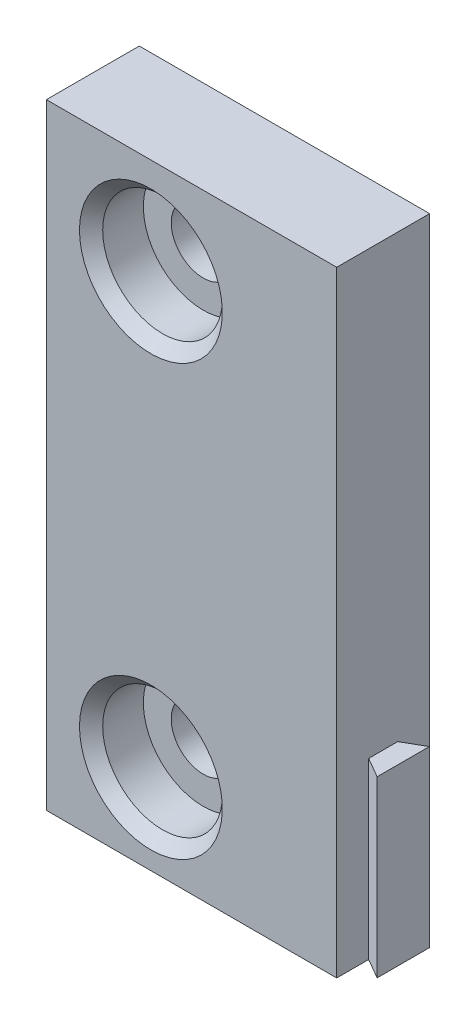
from build123d import *

# Parameters (mm, degrees)
SKETCH2_W           = 25
SKETCH2_H           = 53
SKETCH2_R           = 2.75
BOSS_EXTRUDE1_DEPTH = 8
BOSS_EXTRUDE2_DEPTH = 15
SKETCH4_R           = 5.15
CUT_EXTRUDE1_DEPTH  = 4.5
CHAMFER1_SIZE       = 1


with BuildPart() as part:
    # Sketch2 → Boss-Extrude1 (new body)
    with BuildSketch(Plane.XY):
        with Locations((12.5, 26.5)):
            Rectangle(SKETCH2_W, SKETCH2_H)
        with Locations((9, 44.7)):
            Circle(SKETCH2_R, mode=Mode.SUBTRACT)
        with Locations((9, 7.7)):
            Circle(SKETCH2_R, mode=Mode.SUBTRACT)
    extrude(amount=BOSS_EXTRUDE1_DEPTH)

    # Sketch3 → Boss-Extrude2 (add)
    with BuildSketch(Plane.XZ):
        Polygon((25, 2.75), (26.732050808, 1.75), (26.732050808, 6.25), (25, 5.25), align=None)
    extrude(amount=-BOSS_EXTRUDE2_DEPTH)

    # Sketch4 → Cut-Extrude1 (cut)
    with BuildSketch(Plane.XY.offset(8)):
        with Locations((9, 44.7)):
            Circle(SKETCH4_R)
        with Locations((9, 7.7)):
            Circle(SKETCH4_R)
    extrude(amount=-CUT_EXTRUDE1_DEPTH, mode=Mode.SUBTRACT)

    # Chamfer1
    chamfer1_edges = [part.edges().sort_by_distance(p)[0] for p in [
        (3.85, 44.7, 8),
        (3.85, 7.7, 8),
    ]]
    chamfer(chamfer1_edges, length=CHAMFER1_SIZE)


solid = part.part
